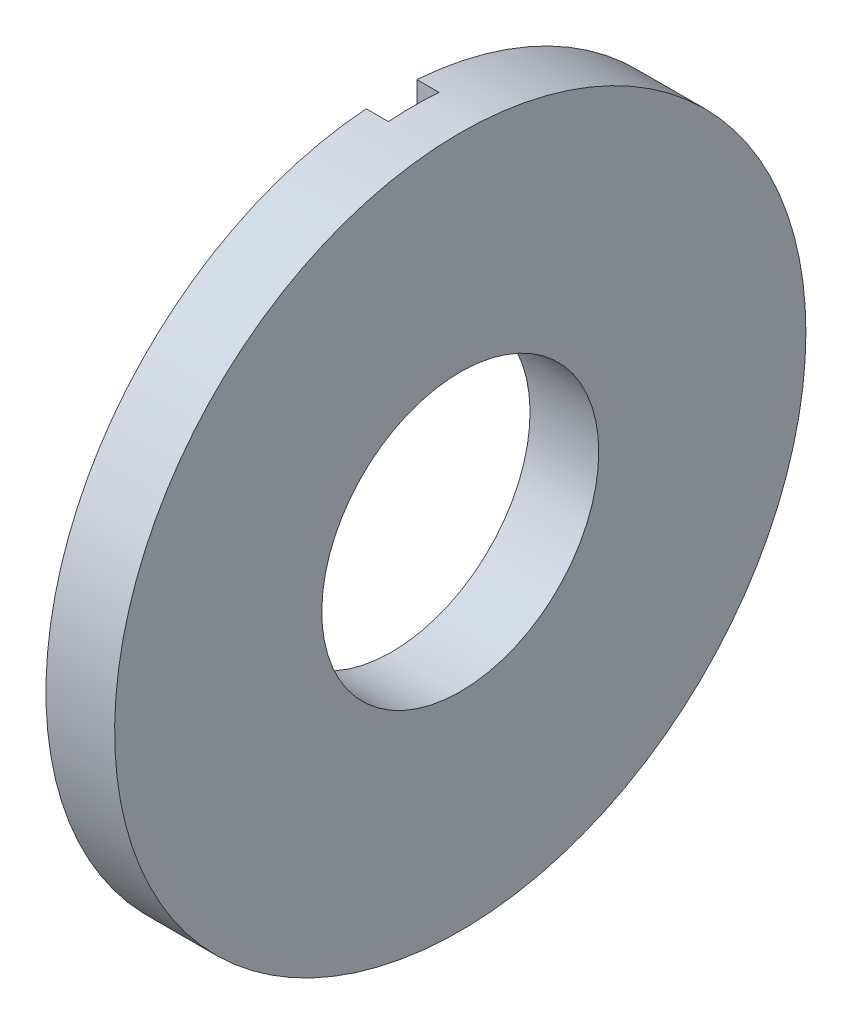
from build123d import *

# Parameters (mm, degrees)
SKETCH1_R           = 3.9624
SKETCH1_R_2         = 1.5875
BOSS_EXTRUDE1_DEPTH = 0.3937
SKETCH5_W           = 0.58047107
SKETCH5_H           = 3.9624
CUT_EXTRUDE1_DEPTH  = 0.254


with BuildPart() as part:
    # Sketch1 → Boss-Extrude1 (new, symmetric)
    with BuildSketch(Plane(origin=(0, 0, 0), x_dir=(0, 0, -1), z_dir=(1, 0, 0))):
        Circle(SKETCH1_R)
        Circle(SKETCH1_R_2, mode=Mode.SUBTRACT)
    extrude(amount=BOSS_EXTRUDE1_DEPTH, both=True)

    # Sketch5 → Cut-Extrude1 (cut)
    with BuildSketch(Plane.ZY.offset(0.3937)):
        with Locations((0, 1.9812)):
            Rectangle(SKETCH5_W, SKETCH5_H)
    extrude(amount=-CUT_EXTRUDE1_DEPTH, mode=Mode.SUBTRACT)


solid = part.part
